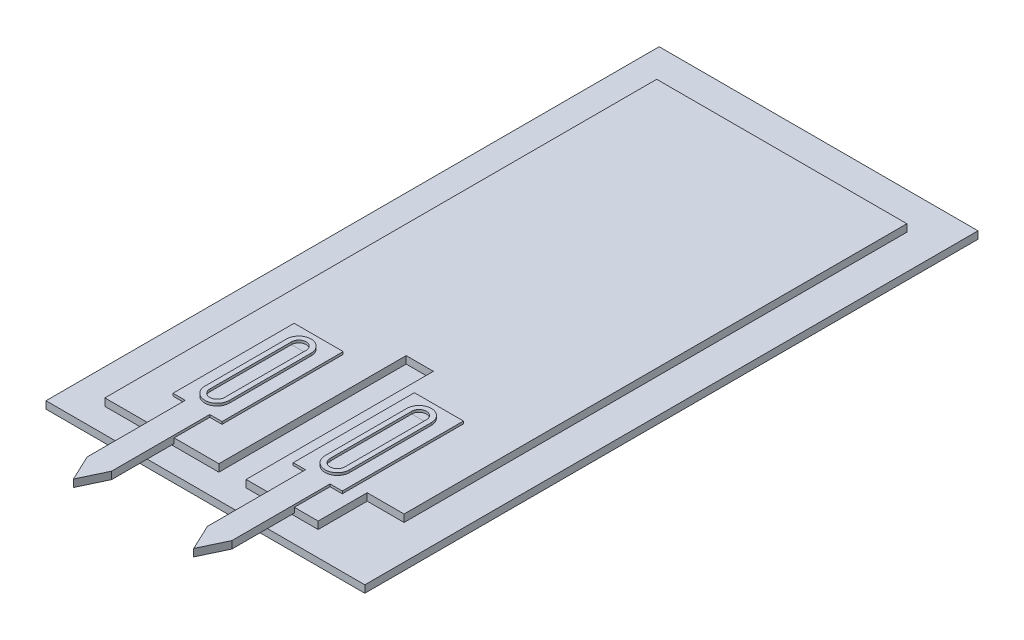
from build123d import *

# Parameters (mm, degrees)
SKETCH1_W                   = 13
SKETCH1_H                   = 25
PLASTIC_COAT_DEPTH          = 0.3
ALUMINUM_EXTRUDE_DEPTH      = 0.3
ALUMINUM_EXTRUDE_DEPTH_BACK = 0.3
SENSOR_EXTRUDE_DEPTH        = 0.1
SENSOR_EXTRUDE_DEPTH_BACK   = 0.2
SENSOR_EXTRUDE_2_DEPTH      = 0.1
SENSOR_EXTRUDE_2_DEPTH_BACK = 0.2
BOSS_EXTRUDE6_DEPTH         = 0.1
BOSS_EXTRUDE6_DEPTH_BACK    = 0.1
BOSS_EXTRUDE6_2_DEPTH       = 0.1
BOSS_EXTRUDE6_2_DEPTH_BACK  = 0.1
CUT_EXTRUDE2_DEPTH          = 0.1
CUT_EXTRUDE3_DEPTH          = 0.1


with BuildPart() as part:
    # Sketch1 → plastic coat (new body)
    with BuildSketch(Plane(origin=(0, 0, 0), x_dir=(1, 0, 0), z_dir=(0, 1, 0))):
        with Locations((6.5, 12.5)):
            Rectangle(SKETCH1_W, SKETCH1_H)
    extrude(amount=PLASTIC_COAT_DEPTH)


with BuildPart() as body_2:
    # Sketch2 → aluminum extrude (new, two sides: drawn at the far end of the back side and taken through both)
    with BuildSketch(Plane(origin=(0, 0.3, 0), x_dir=(1, 0, 0), z_dir=(0, 1, 0)).offset(-ALUMINUM_EXTRUDE_DEPTH_BACK)):
        Polygon((1.4, 1), (6.049, 1), (6.049, 8.636), (7.159, 8.636), (7.159, 2.740696479), (7.159, 1), (10.096405054, 1), (10.096405054, 3), (11.6, 3), (11.6, 23.5), (1.4, 23.5), align=None)
    extrude(amount=ALUMINUM_EXTRUDE_DEPTH + ALUMINUM_EXTRUDE_DEPTH_BACK)


with BuildPart() as body_3:
    # Sketch3 → sensor extrude (new, two sides: drawn at the far end of the back side and taken through both)
    with BuildSketch(Plane(origin=(0, 0.6, 0), x_dir=(1, 0, 0), z_dir=(0, 1, 0)).offset(-SENSOR_EXTRUDE_DEPTH_BACK)):
        Polygon((2.7245, 7.393511148), (2.7245, 2.452413967), (3.2245, 2.452413967), (3.2245, -1.547586033), (3.7245, -2.606488852), (4.2245, -1.547586033), (4.2245, 2.452413967), (4.7245, 2.452413967), (4.7245, 7.393511148), align=None)
    extrude(amount=SENSOR_EXTRUDE_DEPTH + SENSOR_EXTRUDE_DEPTH_BACK)


with BuildPart() as body_4:
    # Sketch3 → sensor extrude 2 (new, two sides: drawn at the far end of the back side and taken through both)
    with BuildSketch(Plane(origin=(0, 0.6, 0), x_dir=(1, 0, 0), z_dir=(0, 1, 0)).offset(-SENSOR_EXTRUDE_2_DEPTH_BACK)):
        Polygon((7.627702527, 7.393511148), (9.627702527, 7.393511148), (9.627702527, 2.452413967), (9.127702527, 2.452413967), (9.127702527, -1.547586033), (8.627702527, -2.605366729), (8.127702527, -1.547586033), (8.127702527, 2.452413967), (7.627702527, 2.452413967), align=None)
    extrude(amount=SENSOR_EXTRUDE_2_DEPTH + SENSOR_EXTRUDE_2_DEPTH_BACK)


with BuildPart() as body_5:
    # Sketch4 → Boss-Extrude6 (new, two sides: drawn at the far end of the back side and taken through both)
    with BuildSketch(Plane(origin=(0, 0.7, 0), x_dir=(1, 0, 0), z_dir=(0, 1, 0)).offset(-BOSS_EXTRUDE6_DEPTH_BACK)):
        with BuildLine():
            Line((4.2245, 6.584596811), (4.2245, 3.252413967))
            ThreePointArc((4.2245, 3.252413967), (3.7245, 2.752413967), (3.2245, 3.252413967))
            Line((3.2245, 3.252413967), (3.2245, 6.584596811))
            ThreePointArc((3.2245, 6.584596811), (3.7245, 7.084596811), (4.2245, 6.584596811))
        make_face()
    extrude(amount=BOSS_EXTRUDE6_DEPTH + BOSS_EXTRUDE6_DEPTH_BACK)

    # Sketch11 → Cut-Extrude3 (cut)
    with BuildSketch(Plane(origin=(0, 0.8, 0), x_dir=(1, 0, 0), z_dir=(0, 1, 0))):
        with BuildLine():
            Line((3.4245, 6.584596811), (3.4245, 3.252413967))
            ThreePointArc((3.4245, 3.252413967), (3.7245, 2.952413967), (4.0245, 3.252413967))
            Line((4.0245, 3.252413967), (4.0245, 6.584596811))
            ThreePointArc((4.0245, 6.584596811), (3.7245, 6.884596811), (3.4245, 6.584596811))
        make_face()
    extrude(amount=-CUT_EXTRUDE3_DEPTH, mode=Mode.SUBTRACT)


with BuildPart() as body_6:
    # Sketch4 → Boss-Extrude6 2 (new, two sides: drawn at the far end of the back side and taken through both)
    with BuildSketch(Plane(origin=(0, 0.7, 0), x_dir=(1, 0, 0), z_dir=(0, 1, 0)).offset(-BOSS_EXTRUDE6_2_DEPTH_BACK)):
        with BuildLine():
            Line((9.127702527, 6.584596811), (9.127702527, 3.252413967))
            ThreePointArc((9.127702527, 3.252413967), (8.627702527, 2.752413967), (8.127702527, 3.252413967))
            Line((8.127702527, 3.252413967), (8.127702527, 6.584596811))
            ThreePointArc((8.127702527, 6.584596811), (8.627702527, 7.084596811), (9.127702527, 6.584596811))
        make_face()
    extrude(amount=BOSS_EXTRUDE6_2_DEPTH + BOSS_EXTRUDE6_2_DEPTH_BACK)

    # Sketch10 → Cut-Extrude2 (cut)
    with BuildSketch(Plane(origin=(0, 0.8, 0), x_dir=(1, 0, 0), z_dir=(0, 1, 0))):
        with BuildLine():
            Line((8.327702527, 6.584596811), (8.327702527, 3.252413967))
            ThreePointArc((8.327702527, 3.252413967), (8.627702527, 2.952413967), (8.927702527, 3.252413967))
            Line((8.927702527, 3.252413967), (8.927702527, 6.584596811))
            ThreePointArc((8.927702527, 6.584596811), (8.627702527, 6.884596811), (8.327702527, 6.584596811))
        make_face()
    extrude(amount=-CUT_EXTRUDE2_DEPTH, mode=Mode.SUBTRACT)


solid = Compound([part.part, body_2.part, body_3.part, body_4.part, body_5.part, body_6.part])
